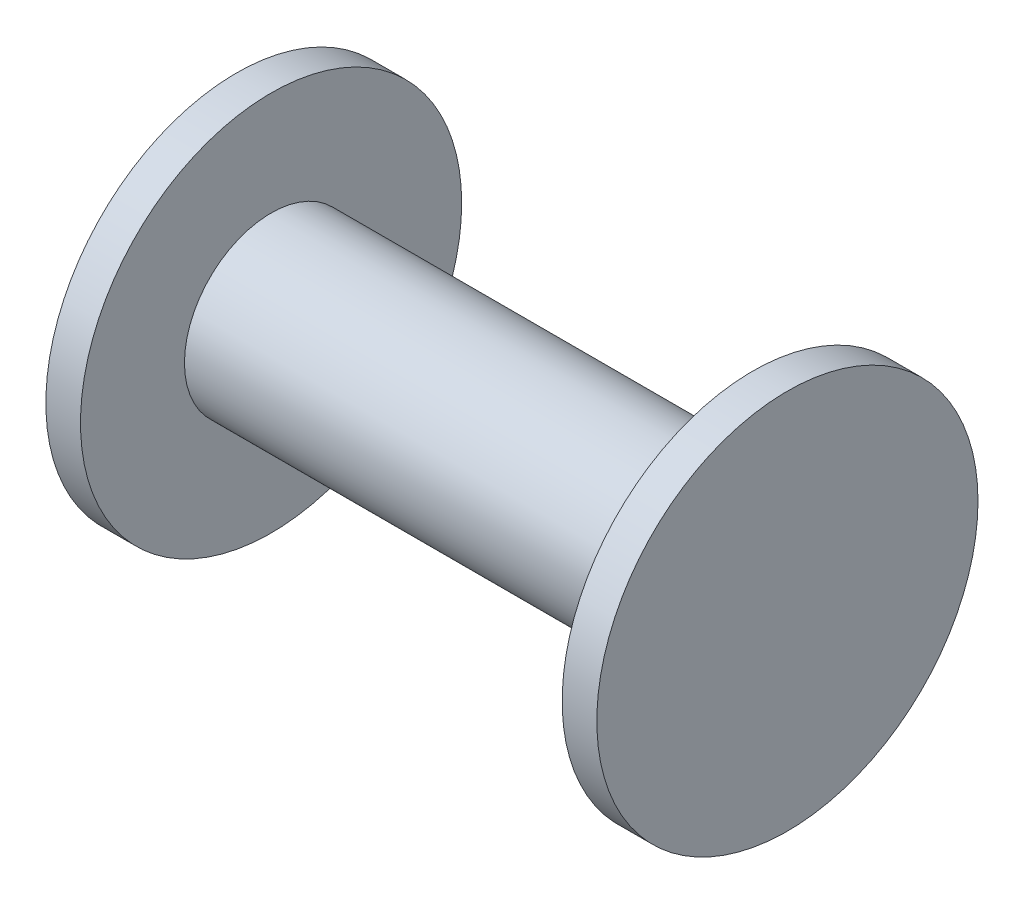
from build123d import *

# Parameters (mm, degrees)
SKETCH1_R           = 5
BOSS_EXTRUDE1_DEPTH = 15.9
SKETCH2_R           = 11
BOSS_EXTRUDE2_DEPTH = 2


with BuildPart() as part:
    # Sketch1 → Boss-Extrude1 (new, symmetric)
    with BuildSketch(Plane(origin=(0, 0, 0), x_dir=(0, 0, -1), z_dir=(1, 0, 0))):
        Circle(SKETCH1_R)
    extrude(amount=BOSS_EXTRUDE1_DEPTH, both=True)

    # Sketch2 → Boss-Extrude2 (add)
    with BuildSketch(Plane(origin=(15.9, 0, 0), x_dir=(0, 0, -1), z_dir=(1, 0, 0))):
        Circle(SKETCH2_R)
    boss_extrude2 = extrude(amount=-BOSS_EXTRUDE2_DEPTH)

    # Mirror1: Boss-Extrude2 across plane
    add(boss_extrude2.mirror(Plane(origin=(0, 0, 0), x_dir=(0, 0, 1), z_dir=(1, 0, 0))))


solid = part.part
